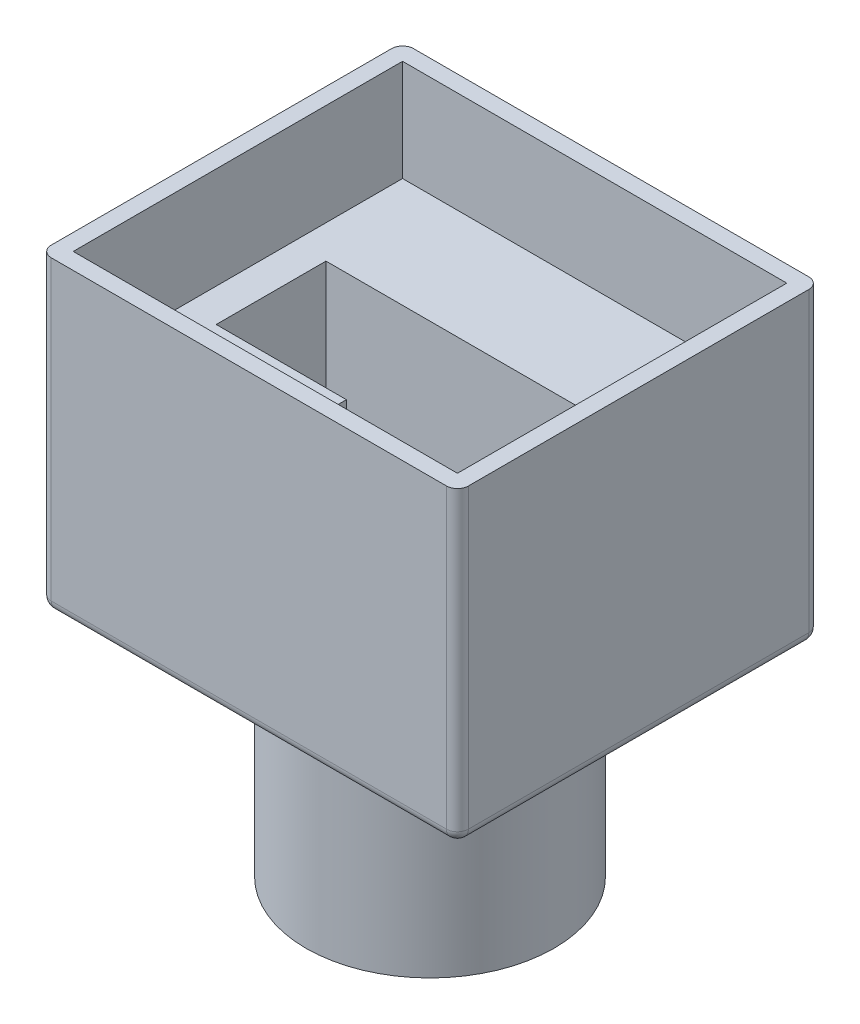
from build123d import *

# Parameters (mm, degrees)
SKETCH1_W           = 76
SKETCH1_H           = 66
SKETCH1_W_2         = 70
SKETCH1_H_2         = 60
BOSS_EXTRUDE1_DEPTH = 18.5
SKETCH2_W           = 76
SKETCH2_H           = 66
SKETCH2_W_2         = 70
SKETCH2_H_2         = 60
BOSS_EXTRUDE2_DEPTH = 27.65
SKETCH4_W           = 76
SKETCH4_H           = 66
BOSS_EXTRUDE3_DEPTH = 10
SKETCH5_R           = 22.6
SKETCH5_R_2         = 19.6
BOSS_EXTRUDE4_DEPTH = 40
FILLET1_R           = 2
FILLET2_R           = 2


with BuildPart() as part:
    # Sketch1 → Boss-Extrude1 (new body)
    with BuildSketch(Plane(origin=(0, 0, 0), x_dir=(1, 0, 0), z_dir=(0, 1, 0))):
        Rectangle(SKETCH1_W, SKETCH1_H)
        Rectangle(SKETCH1_W_2, SKETCH1_H_2, mode=Mode.SUBTRACT)
    extrude(amount=BOSS_EXTRUDE1_DEPTH)

    # Sketch2 → Boss-Extrude2 (add)
    # profile 1 of 2: a face of its own
    with BuildSketch(Plane.XZ):
        Rectangle(SKETCH2_W, SKETCH2_H)
        Rectangle(SKETCH2_W_2, SKETCH2_H_2, mode=Mode.SUBTRACT)
    # profile 2 of 2: a face of its own
    with BuildSketch(Plane.XZ):
        Polygon((-28.95, 10), (-5.225, 10), (-5.225, 30), (-35, 30), (-35, -30), (35, -30), (35, -5), (18.5, -5), (18.5, -10), (-28.95, -10), align=None)
    extrude(amount=BOSS_EXTRUDE2_DEPTH)

    # Sketch4 → Boss-Extrude3 (add)
    with BuildSketch(Plane.XZ.offset(27.65)):
        Rectangle(SKETCH4_W, SKETCH4_H)
    extrude(amount=BOSS_EXTRUDE3_DEPTH)

    # Sketch5 → Boss-Extrude4 (add)
    with BuildSketch(Plane.XZ.offset(37.65)):
        with Locations(Location((0, 0, 0), (0, 0, 270))):
            Circle(SKETCH5_R)
        with Locations(Location((0, 0, 0), (0, 0, 270))):
            Circle(SKETCH5_R_2, mode=Mode.SUBTRACT)
    extrude(amount=BOSS_EXTRUDE4_DEPTH)

    # Fillet1
    fillet1_edges = [part.edges().sort_by_distance(p)[0] for p in [
        (38, -9.575, 33),
        (-38, -9.575, 33),
        (-38, -9.575, -33),
        (38, -9.575, -33),
    ]]
    fillet(fillet1_edges, radius=FILLET1_R)

    # Fillet2
    fillet2_edges = [part.edges().sort_by_distance(p)[0] for p in [
        (0, -37.65, -33),
        (38, -37.65, 0),
        (0, -37.65, 33),
        (-38, -37.65, 0),
        (-37.414213562, -37.65, 32.414213562),
        (37.414213562, -37.65, 32.414213562),
        (-37.414213562, -37.65, -32.414213562),
        (37.414213562, -37.65, -32.414213562),
    ]]
    fillet(fillet2_edges, radius=FILLET2_R)


solid = part.part
